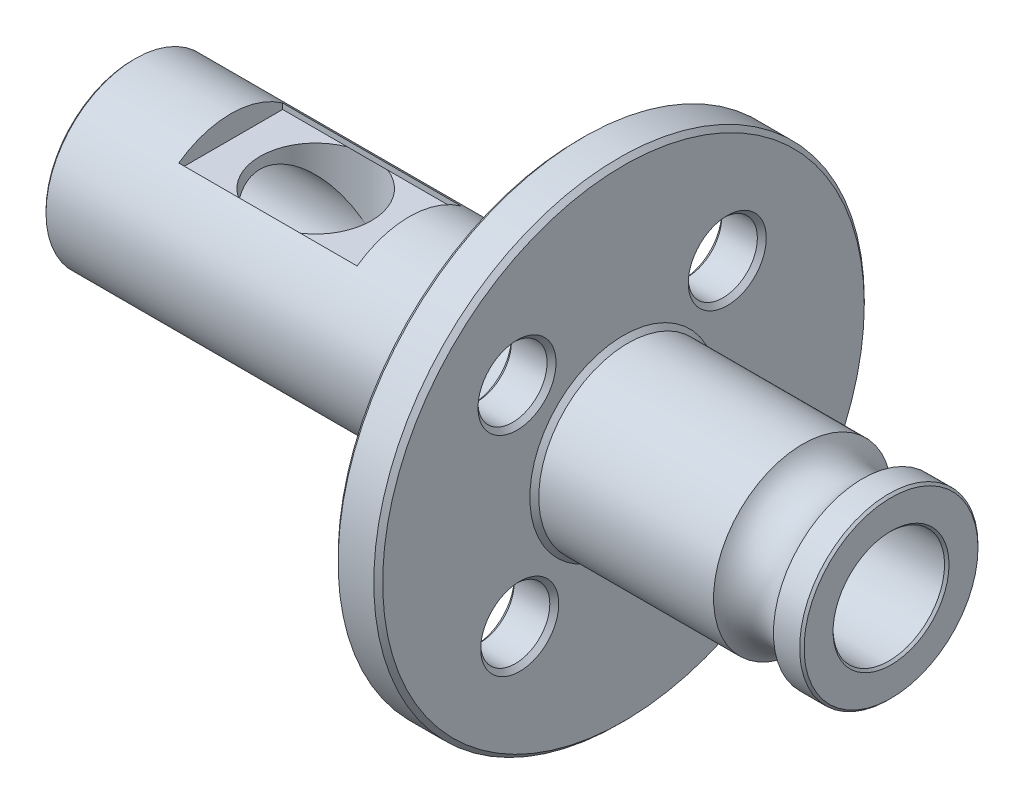
from build123d import *

# Parameters (mm, degrees)
SKETCH2_R               = 11
BOSS_EXTRUDE1_DEPTH     = 2
SKETCH3_R               = 2.5
CUT_EXTRUDE1_DEPTH      = 38.389838192
SKETCH4_W               = 8
SKETCH4_H               = 4.66
CUT_EXTRUDE2_DEPTH      = 1
CUT_EXTRUDE3_REACH      = 30.302
CUT_EXTRUDE3_END_RADIUS = 2.5
SKETCH5_R               = 2.5
SKETCH6_R               = 1.55
CUT_EXTRUDE4_DEPTH      = 27.944387171
CHAMFER1_SIZE           = 0.2
CHAMFER2_SIZE           = 0.1


with BuildPart() as part:
    # Sketch1 → Revolve1 (revolve)
    with BuildSketch(Plane(origin=(0, 0, 0), x_dir=(1, 0, 0), z_dir=(0, 1, 0))):
        with BuildLine():
            Line((-22, 4), (8.040136982, 4))
            ThreePointArc((8.040136982, 4), (9.382757902, 3.250506535), (10.725378822, 4))
            Line((10.725378822, 4), (12, 4))
            Line((12, 4), (12, 0))
            Line((12, 0), (-22, 0))
            Line((-22, 0), (-22, 4))
        make_face()
    revolve(axis=Axis((12, 0, 0), (-1, 0, 0)))

    # Sketch2 → Boss-Extrude1 (add)
    with BuildSketch(Plane(origin=(0, 0, 0), x_dir=(0, 0, -1), z_dir=(1, 0, 0))):
        Circle(SKETCH2_R)
    extrude(amount=-BOSS_EXTRUDE1_DEPTH)

    # Sketch3 → Cut-Extrude1 (cut, through all)
    with BuildSketch(Plane(origin=(12, 0, 0), x_dir=(0, 0, -1), z_dir=(1, 0, 0))):
        Circle(SKETCH3_R)
    extrude(amount=-CUT_EXTRUDE1_DEPTH, mode=Mode.SUBTRACT)

    # Sketch4 → Cut-Extrude2 (cut)
    with BuildSketch(Plane(origin=(0, 4, 0), x_dir=(1, 0, 0), z_dir=(0, 1, 0))):
        with Locations((-13.616018874, 0)):
            Rectangle(SKETCH4_W, SKETCH4_H)
    extrude(amount=-CUT_EXTRUDE2_DEPTH, mode=Mode.SUBTRACT)

    # Cut-Extrude3: up to this cylinder (the profile starts outside it)
    cut_extrude3_end = Plane(origin=(-13.804261, 0, 0), z_dir=(1, 0, 0)) * Cylinder(CUT_EXTRUDE3_END_RADIUS, 66.604, mode=Mode.PRIVATE)
    # Sketch5 → Cut-Extrude3 (cut, up to the surface)
    with BuildSketch(Plane(origin=(0, 3, 0), x_dir=(1, 0, 0), z_dir=(0, 1, 0)), mode=Mode.PRIVATE) as cut_extrude3_sk1:
        with Locations(Location((-13.804261439, 0, 0), (0, 0, 270))):
            Circle(SKETCH5_R)
    cut_extrude3_tool1 = extrude(cut_extrude3_sk1.sketch, amount=-CUT_EXTRUDE3_REACH, mode=Mode.PRIVATE) - cut_extrude3_end
    add(cut_extrude3_tool1.solids().sort_by_distance((-13.804261, 3, 0))[0], mode=Mode.SUBTRACT)

    # Sketch6 → Cut-Extrude4 (cut, through all)
    with BuildSketch(Plane(origin=(0, 0, 0), x_dir=(0, 0, -1), z_dir=(1, 0, 0))):
        with Locations((-4.776443449, 4.654384475)):
            Circle(SKETCH6_R)
        with Locations((4.654384475, 4.776443449)):
            Circle(SKETCH6_R)
        with Locations((4.776443449, -4.654384475)):
            Circle(SKETCH6_R)
        with Locations((-4.654384475, -4.776443449)):
            Circle(SKETCH6_R)
    extrude(amount=-CUT_EXTRUDE4_DEPTH, mode=Mode.SUBTRACT)

    # Chamfer1
    chamfer1_edges = [part.edges().sort_by_distance(p)[0] for p in [
        (0, 0, 4),
        (-2, 0, 4),
        (-2, 0, 11),
        (0, 0, 11),
        (-2, -4.776443449, 6.204384475),
        (0, -4.776443449, 6.204384475),
        (-2, -4.654384475, -3.226443449),
        (0, -4.654384475, -3.226443449),
        (-2, 4.776443449, -3.104384475),
        (0, 4.776443449, -3.104384475),
        (-2, 4.654384475, 6.326443449),
        (0, 4.654384475, 6.326443449),
    ]]
    chamfer(chamfer1_edges, length=CHAMFER1_SIZE)

    # Chamfer2
    chamfer2_edges = [part.edges().sort_by_distance(p)[0] for p in [
        (-22, 0, 2.5),
        (12, 0, 2.5),
        (-22, 0, 4),
        (12, 0, 4),
    ]]
    chamfer(chamfer2_edges, length=CHAMFER2_SIZE)


solid = part.part
